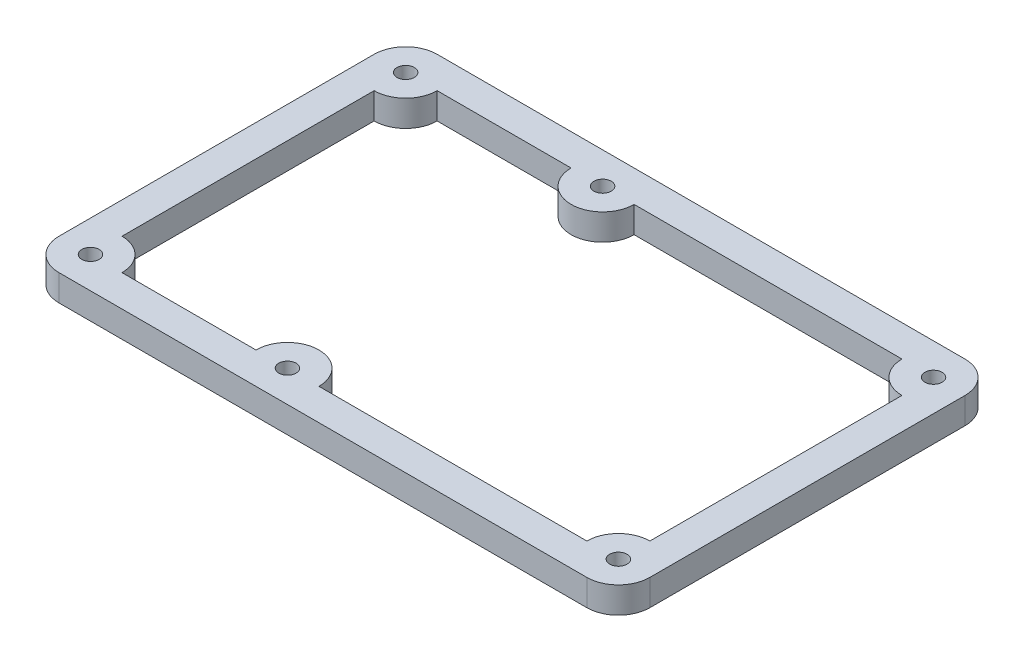
from build123d import *

# Parameters (mm, degrees)
SKETCH_1_R      = 1.65
EXTRUDE_1_DEPTH = 5


with BuildPart() as part:
    # 草图1 → 凸台-拉伸1 (new body)
    with BuildSketch(Plane(origin=(0, 0, 0), x_dir=(1, 0, 0), z_dir=(0, 1, 0))):
        with BuildLine():
            Line((-62.785835682, 53.136639907), (-62.785835682, -6.863360093))
            ThreePointArc((-62.785835682, -6.863360093), (-61.028476369, -11.10600078), (-56.785835682, -12.863360093))
            Line((-56.785835682, -12.863360093), (43.714164318, -12.863360093))
            ThreePointArc((43.714164318, -12.863360093), (47.956805005, -11.10600078), (49.714164318, -6.863360093))
            Line((49.714164318, -6.863360093), (49.714164318, 53.136639907))
            ThreePointArc((49.714164318, 53.136639907), (47.956805005, 57.379280594), (43.714164318, 59.136639907))
            Line((43.714164318, 59.136639907), (-56.785835682, 59.136639907))
            ThreePointArc((-56.785835682, 59.136639907), (-61.028476369, 57.379280594), (-62.785835682, 53.136639907))
        make_face()
        with Locations(Location((-56.785835682, 53.136639907, 0), (0, 0, 270))):
            Circle(SKETCH_1_R, mode=Mode.SUBTRACT)
        with Locations(Location((-19.285835682, 53.136639907, 0), (0, 0, 270))):
            Circle(SKETCH_1_R, mode=Mode.SUBTRACT)
        with Locations(Location((43.714164318, 53.136639907, 0), (0, 0, 270))):
            Circle(SKETCH_1_R, mode=Mode.SUBTRACT)
        with Locations(Location((-56.785835682, -6.863360093, 0), (0, 0, 270))):
            Circle(SKETCH_1_R, mode=Mode.SUBTRACT)
        with Locations(Location((-19.285835682, -6.863360093, 0), (0, 0, 270))):
            Circle(SKETCH_1_R, mode=Mode.SUBTRACT)
        with Locations(Location((43.714164318, -6.863360093, 0), (0, 0, 270))):
            Circle(SKETCH_1_R, mode=Mode.SUBTRACT)
        with BuildLine():
            Line((-50.785835682, -6.863360093), (-25.285835682, -6.863360093))
            ThreePointArc((-25.285835682, -6.863360093), (-19.285835682, -0.863360093), (-13.285835682, -6.863360093))
            Line((-13.285835682, -6.863360093), (37.714164318, -6.863360093))
            ThreePointArc((37.714164318, -6.863360093), (39.471523631, -2.620719406), (43.714164318, -0.863360093))
            Line((43.714164318, -0.863360093), (43.714164318, 47.136639907))
            ThreePointArc((43.714164318, 47.136639907), (39.471523631, 48.89399922), (37.714164318, 53.136639907))
            Line((37.714164318, 53.136639907), (-13.285835682, 53.136639907))
            ThreePointArc((-13.285835682, 53.136639907), (-19.285835682, 47.136639907), (-25.285835682, 53.136639907))
            Line((-25.285835682, 53.136639907), (-50.785835682, 53.136639907))
            ThreePointArc((-50.785835682, 53.136639907), (-52.543194995, 48.89399922), (-56.785835682, 47.136639907))
            Line((-56.785835682, 47.136639907), (-56.785835682, -0.863360093))
            ThreePointArc((-56.785835682, -0.863360093), (-52.543194995, -2.620719406), (-50.785835682, -6.863360093))
        make_face(mode=Mode.SUBTRACT)
    extrude(amount=EXTRUDE_1_DEPTH)


solid = part.part
